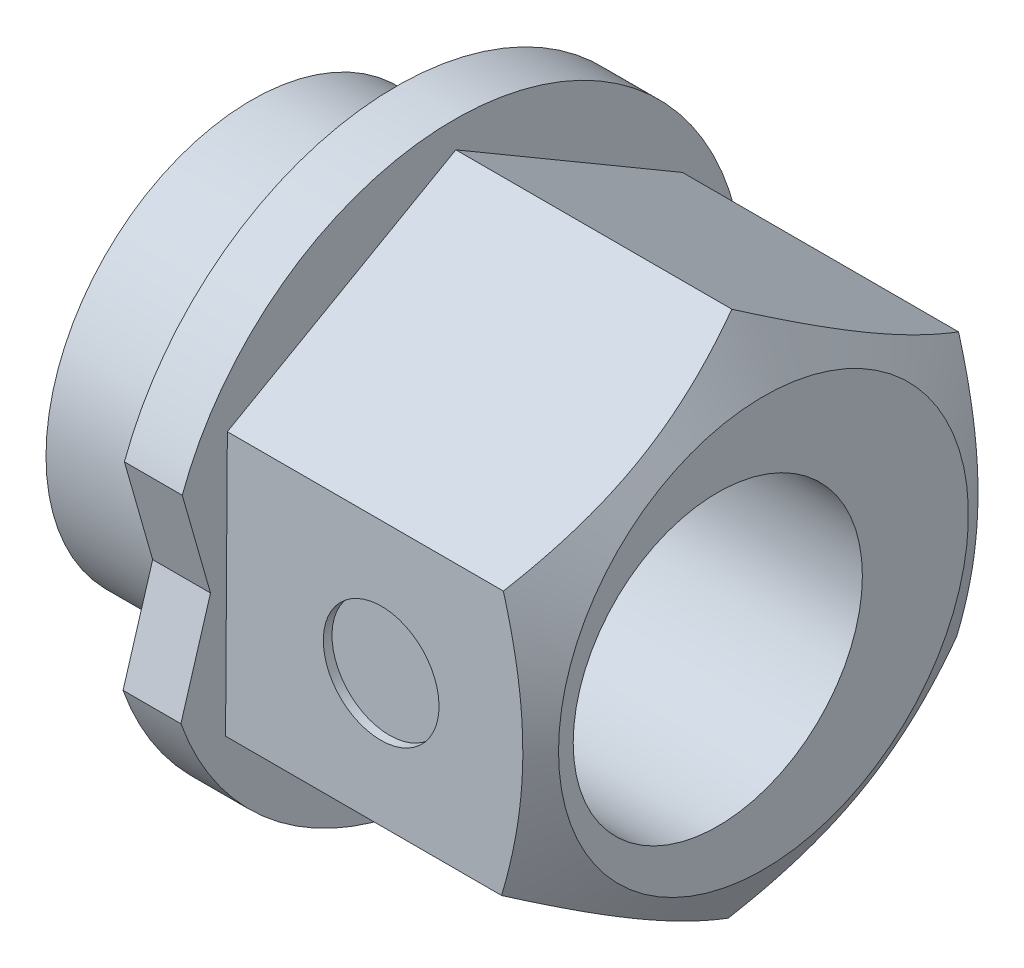
from build123d import *

# Parameters (mm, degrees)
BOSS_EXTRUDE1_DEPTH = 5.35
BOSS_EXTRUDE3_DEPTH = 1
SKETCH4_R           = 3.555
BOSS_EXTRUDE4_DEPTH = 2.5
SKETCH5_R           = 1
CUT_EXTRUDE3_DEPTH  = 0.15
SKETCH3_R           = 2.5
CUT_EXTRUDE5_DEPTH  = 12.336785259


with BuildPart() as part:
    # Sketch2 → Boss-Extrude1 (new body)
    with BuildSketch(Plane(origin=(0, 0, 0), x_dir=(0, 0, -1), z_dir=(1, 0, 0))):
        Polygon((3.919437566, -2.29861752), (3.950379949, 2.245023741), (0.030942383, 4.54364126), (-3.919437566, 2.29861752), (-3.950379949, -2.245023741), (-0.030942383, -4.54364126), align=None)
    extrude(amount=BOSS_EXTRUDE1_DEPTH)

    # Sketch6 → Boss-Extrude3 (add)
    with BuildSketch(Plane.ZY):
        with BuildLine():
            Line((4.699218, 1.737080939), (4.210840713, 0.028675997))
            Line((4.210840713, 0.028675997), (4.722440239, -1.672919061))
            ThreePointArc((4.722440239, -1.672919061), (-5.009883831, -0.034117514), (4.699218, 1.737080939))
        make_face()
    extrude(amount=BOSS_EXTRUDE3_DEPTH)

    # Sketch4 → Boss-Extrude4 (add)
    with BuildSketch(Plane.ZY.offset(1)):
        Circle(SKETCH4_R)
    extrude(amount=BOSS_EXTRUDE4_DEPTH)

    # Sketch5 → Cut-Extrude3 (cut)
    with BuildSketch(Plane(origin=(0, 0.02679689, 3.934908757), x_dir=(1, 0, 0), z_dir=(0, -0.006809882993303443, -0.9999768124779782))):
        with Locations(Location((2.675, 0, 0), (0, 0, 90))):
            Circle(SKETCH5_R)
    extrude(amount=CUT_EXTRUDE3_DEPTH, mode=Mode.SUBTRACT)

    # Sketch3 → Cut-Extrude5 (cut, through all)
    with BuildSketch(Plane.ZY.offset(3.5)):
        with Locations((0.79, 0)):
            Circle(SKETCH3_R)
    extrude(amount=-CUT_EXTRUDE5_DEPTH, mode=Mode.SUBTRACT)

    # Sketch7 → Cut-Revolve1 (revolve, cut)
    with BuildSketch(Plane.XY, mode=Mode.PRIVATE) as cut_revolve1_sk:
        Polygon((4.772649731, 4.54364126), (5.35, 3.54364126), (9.772649731, 3.54364126), (9.772649731, 8.54364126), (4.772649731, 8.54364126), align=None)
    revolve(cut_revolve1_sk.sketch.rotate(Axis((0, 0, 0), (1, 0, 0)), 90), axis=Axis((0, 0, 0), (1, 0, 0)), mode=Mode.SUBTRACT)


solid = part.part
